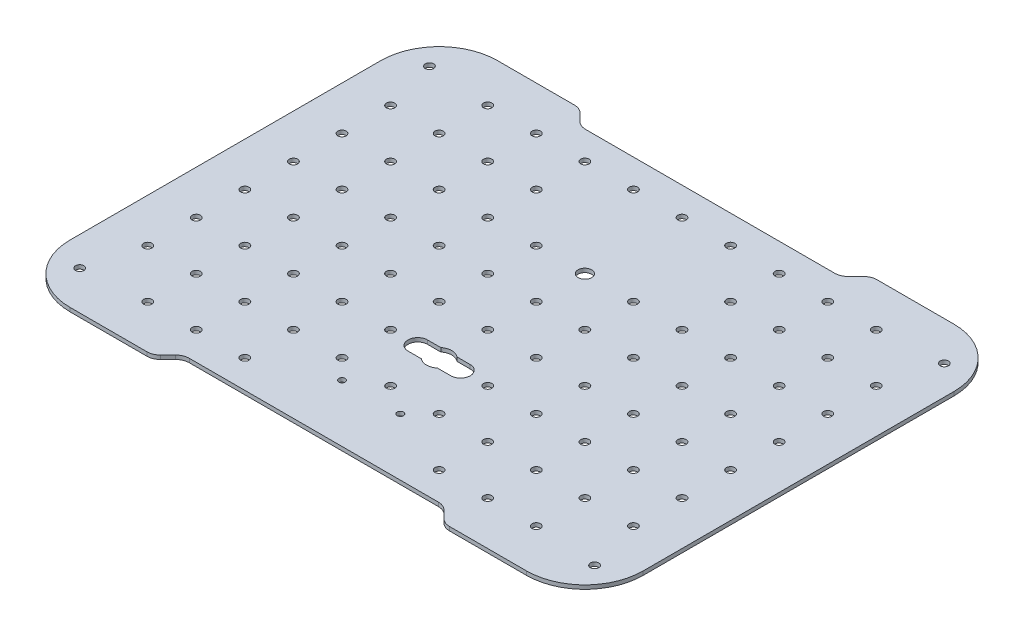
from build123d import *

# Parameters (mm, degrees)
BOSS_EXTRUDE1_DEPTH  = 2
SKETCH8_R            = 2.15
CUT_EXTRUDE11_DEPTH  = 185.011548551
CUT_EXTRUDE12_DEPTH  = 185.011548551
FILLET1_R            = 7
SKETCH11_R           = 6.5
CUT_EXTRUDE14_DEPTH  = 185.011548551
SKETCH10_R           = 2.15
CUT_EXTRUDE13_DEPTH  = 185.011548551
LPATTERN1_COUNT      = 8
LPATTERN1_PITCH      = 25
LPATTERN1_COUNT_DIR2 = 11
LPATTERN1_PITCH_DIR2 = 25
SKETCH18_R           = 1.65
CUT_EXTRUDE21_DEPTH  = 185.011548551
CUT_EXTRUDE22_DEPTH  = 10
SKETCH20_R           = 2.15
BOSS_EXTRUDE2_DEPTH  = 2
SKETCH23_R           = 3.5
CUT_EXTRUDE25_DEPTH  = 10


with BuildPart() as part:
    # Sketch1 → Boss-Extrude1 (new body)
    with BuildSketch(Plane(origin=(0, 0, 0), x_dir=(1, 0, 0), z_dir=(0, 1, 0))):
        with BuildLine():
            Line((117.5, -110), (-117.5, -110))
            ThreePointArc((-117.5, -110), (-138.713203436, -101.213203436), (-147.5, -80))
            Line((-147.5, -80), (-147.5, 80))
            ThreePointArc((-147.5, 80), (-138.713203436, 101.213203436), (-117.5, 110))
            Line((-117.5, 110), (117.5, 110))
            ThreePointArc((117.5, 110), (138.713203436, 101.213203436), (147.5, 80))
            Line((147.5, 80), (147.5, -80))
            ThreePointArc((147.5, -80), (138.713203436, -101.213203436), (117.5, -110))
        make_face()
    extrude(amount=-BOSS_EXTRUDE1_DEPTH)

    # Sketch8 → Cut-Extrude11 (cut, through all)
    with BuildSketch(Plane(origin=(0, 0, 0), x_dir=(1, 0, 0), z_dir=(0, 1, 0))):
        with Locations(Location((-132.5, 90, 0), (0, 0, 270))):
            Circle(SKETCH8_R)
        with Locations(Location((132.5, 90, 0), (0, 0, 270))):
            Circle(SKETCH8_R)
        with Locations(Location((-132.5, -90, 0), (0, 0, 270))):
            Circle(SKETCH8_R)
        with Locations(Location((132.5, -90, 0), (0, 0, 270))):
            Circle(SKETCH8_R)
    extrude(amount=-CUT_EXTRUDE11_DEPTH, mode=Mode.SUBTRACT)

    # Sketch9 → Cut-Extrude12 (cut, through all)
    with BuildSketch(Plane(origin=(0, 0, 0), x_dir=(1, 0, 0), z_dir=(0, 1, 0))):
        Polygon((-75, -110), (-67, -102), (67, -102), (75, -110), align=None)
    cut_extrude12 = extrude(amount=-CUT_EXTRUDE12_DEPTH, mode=Mode.SUBTRACT)

    # Mirror2: Cut-Extrude12 across plane
    add(cut_extrude12.mirror(Plane.XY), mode=Mode.SUBTRACT)

    # Fillet1
    fillet1_edges = [part.edges().sort_by_distance(p)[0] for p in [
        (75, -1, 110),
        (-75, -1, 110),
        (-67, -1, 102),
        (67, -1, 102),
        (-75, -1, -110),
        (75, -1, -110),
        (67, -1, -102),
        (-67, -1, -102),
    ]]
    fillet(fillet1_edges, radius=FILLET1_R)

    # Sketch11 → Cut-Extrude14 (cut, through all)
    with BuildSketch(Plane(origin=(0, 0, 0), x_dir=(1, 0, 0), z_dir=(0, 1, 0))):
        with Locations(Location((0, -37.5, 0), (0, 0, 270))):
            Circle(SKETCH11_R)
    extrude(amount=-CUT_EXTRUDE14_DEPTH, mode=Mode.SUBTRACT)

    # Sketch10 → Cut-Extrude13 (cut, through all)
    with BuildSketch(Plane(origin=(0, 0, 0), x_dir=(1, 0, 0), z_dir=(0, 1, 0))):
        with Locations(Location((-125, 87.5, 0), (0, 0, 270))):
            Circle(SKETCH10_R)
    cut_extrude13 = extrude(amount=-CUT_EXTRUDE13_DEPTH, mode=Mode.SUBTRACT)

    # LPattern1: Cut-Extrude13 8 × 11, 7 skipped
    with Locations(*[(j * LPATTERN1_PITCH_DIR2, 0, i * LPATTERN1_PITCH) for i in range(LPATTERN1_COUNT) for j in range(LPATTERN1_COUNT_DIR2) if (i, j) not in ((0, 0), (1, 4), (1, 5), (1, 6), (5, 5), (7, 4), (7, 5), (7, 6))]):
        add(cut_extrude13, mode=Mode.SUBTRACT)

    # Sketch18 → Cut-Extrude21 (cut, through all)
    with BuildSketch(Plane(origin=(0, 0, 0), x_dir=(1, 0, 0), z_dir=(0, 1, 0))):
        with Locations(Location((15, -72.5, 0), (0, 0, 270))):
            Circle(SKETCH18_R)
        with Locations(Location((-15, -72.5, 0), (0, 0, 270))):
            Circle(SKETCH18_R)
    extrude(amount=-CUT_EXTRUDE21_DEPTH, mode=Mode.SUBTRACT)

    # Sketch19 → Cut-Extrude22 (cut)
    with BuildSketch(Plane(origin=(0, 0, 0), x_dir=(1, 0, 0), z_dir=(0, 1, 0))):
        with BuildLine():
            Line((-11, -32.5), (11, -32.5))
            ThreePointArc((11, -32.5), (16, -37.5), (11, -42.5))
            Line((11, -42.5), (-11, -42.5))
            ThreePointArc((-11, -42.5), (-16, -37.5), (-11, -32.5))
        make_face()
    extrude(amount=-CUT_EXTRUDE22_DEPTH, mode=Mode.SUBTRACT)

    # Sketch20 → Boss-Extrude2 (add)
    with BuildSketch(Plane(origin=(0, 0, 0), x_dir=(1, 0, 0), z_dir=(0, 1, 0))):
        with Locations((125, 87.5)):
            Circle(SKETCH20_R)
        with Locations((125, -87.5)):
            Circle(SKETCH20_R)
        with Locations((-125, -87.5)):
            Circle(SKETCH20_R)
        with Locations((-125, 87.5)):
            Circle(SKETCH20_R)
    extrude(amount=-BOSS_EXTRUDE2_DEPTH)

    # Sketch23 → Cut-Extrude25 (cut)
    with BuildSketch(Plane(origin=(0, 0, 0), x_dir=(1, 0, 0), z_dir=(0, 1, 0))):
        with Locations(Location((0, 37.5, 0), (0, 0, 270))):
            Circle(SKETCH23_R)
    extrude(amount=-CUT_EXTRUDE25_DEPTH, mode=Mode.SUBTRACT)


solid = part.part
